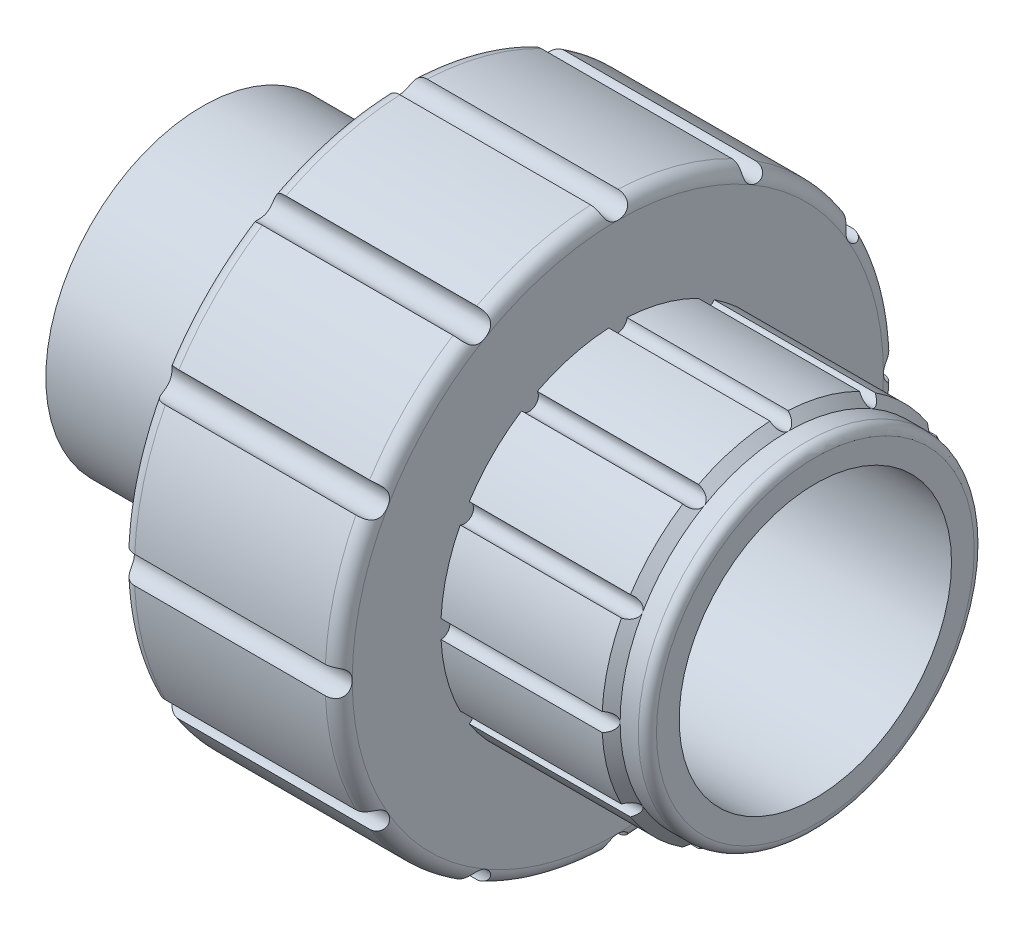
from build123d import *

# Parameters (mm, degrees)
SKETCH_1_R               = 11.5
SKETCH_1_R_2             = 10
EXTRUDE_1_DEPTH          = 45
EXTRUDE_START            = -14.5
SKETCH_2_R               = 20.5
EXTRUDE_1_2_DEPTH        = 30.5
CUT_EXTRUDE_START        = -16
SKETCH_3_OUTSIDE_W       = 57.68
SKETCH_3_OUTSIDE_H       = 57.68
SKETCH_3_OUTSIDE_R       = 13
CUT_EXTRUDE_1_DEPTH      = 27.080280417
FILLET_2_R               = 1
CUT_EXTRUDE_2_REACH      = 44.08
SKETCH_4_R               = 1
SKETCH_5_R               = 0.666666667
CUT_EXTRUDE_3_DEPTH      = 14.5
PATTERN_CIRCULAR_1_COUNT = 12
SKETCH_6_OUTSIDE_W       = 57.62
SKETCH_6_OUTSIDE_H       = 57.62
SKETCH_6_OUTSIDE_R       = 12.333333333
CUT_EXTRUDE_4_DEPTH      = 2
SKETCH_7_R               = 10
CUT_EXTRUDE_5_DEPTH      = 54.511692161
FILLET_3_R               = 0.666666667
SKETCH_8_OUTSIDE_W       = 61.62
SKETCH_8_OUTSIDE_H       = 61.62
SKETCH_8_OUTSIDE_R       = 12.333333333
CUT_EXTRUDE_6_DEPTH      = 2
CUT_EXTRUDE_6_DRAFT      = -45


with BuildPart() as part:
    # Эскиз1 → Extrude 1 (new body)
    with BuildSketch(Plane(origin=(0, 0, 0), x_dir=(0, 0, -1), z_dir=(1, 0, 0))):
        Circle(SKETCH_1_R)
        Circle(SKETCH_1_R_2, mode=Mode.SUBTRACT)
    extrude(amount=-EXTRUDE_1_DEPTH)

    # Эскиз2 → Extrude 1 2 (add)
    with BuildSketch(Plane.ZY.offset(45).offset(EXTRUDE_START)):
        Circle(SKETCH_2_R)
    extrude(amount=-EXTRUDE_1_2_DEPTH)

    # Эскиз3 outside → Вырез-Вытянуть1 (cut, through all)
    with BuildSketch(Plane.ZY.offset(30.5).offset(CUT_EXTRUDE_START)):
        Rectangle(SKETCH_3_OUTSIDE_W, SKETCH_3_OUTSIDE_H)
        Circle(SKETCH_3_OUTSIDE_R, mode=Mode.SUBTRACT)
    extrude(amount=-CUT_EXTRUDE_1_DEPTH, mode=Mode.SUBTRACT)

    # Скругление2
    fillet_2_edges = [part.edges().sort_by_distance(p)[0] for p in [
        (-30.5, 0, -20.5),
        (-14.5, 0, -20.5),
    ]]
    fillet(fillet_2_edges, radius=FILLET_2_R)

    # Эскиз4 → Вырез-Вытянуть2 (cut, up to next)
    with BuildSketch(Plane.ZY.offset(30.5), mode=Mode.PRIVATE) as cut_extrude_2_sk1:
        with Locations((0, 20.5)):
            Circle(SKETCH_4_R)
    cut_extrude_2_tool1 = extrude(cut_extrude_2_sk1.sketch, amount=-CUT_EXTRUDE_2_REACH, mode=Mode.PRIVATE) & part.part
    cut_extrude_2 = cut_extrude_2_tool1.solids().sort_by_distance((-30.5, 20.5, 0))[0]
    add(cut_extrude_2, mode=Mode.SUBTRACT)

    # Эскиз5 → Вырез-Вытянуть3 (cut)
    with BuildSketch(Plane(origin=(0, 0, 0), x_dir=(0, 0, -1), z_dir=(1, 0, 0))):
        with Locations((0, 13)):
            Circle(SKETCH_5_R)
    cut_extrude_3 = extrude(amount=-CUT_EXTRUDE_3_DEPTH, mode=Mode.SUBTRACT)

    # Круговой массив1: Вырез-Вытянуть2, Вырез-Вытянуть3 ×12 about axis
    pattern_circular_1_axis = Axis((0, 0, 0), (1, 0, 0))
    add([cut_extrude_2.rotate(pattern_circular_1_axis, i * 360 / PATTERN_CIRCULAR_1_COUNT) for i in range(1, PATTERN_CIRCULAR_1_COUNT)], mode=Mode.SUBTRACT)
    add([cut_extrude_3.rotate(pattern_circular_1_axis, i * 360 / PATTERN_CIRCULAR_1_COUNT) for i in range(1, PATTERN_CIRCULAR_1_COUNT)], mode=Mode.SUBTRACT)

    # Эскиз6 outside → Вырез-Вытянуть4 (cut)
    with BuildSketch(Plane(origin=(0, 0, 0), x_dir=(0, 0, -1), z_dir=(1, 0, 0))):
        Rectangle(SKETCH_6_OUTSIDE_W, SKETCH_6_OUTSIDE_H)
        Circle(SKETCH_6_OUTSIDE_R, mode=Mode.SUBTRACT)
    extrude(amount=-CUT_EXTRUDE_4_DEPTH, mode=Mode.SUBTRACT)

    # Эскиз7 → Вырез-Вытянуть5 (cut, through all)
    with BuildSketch(Plane(origin=(0, 0, 0), x_dir=(0, 0, -1), z_dir=(1, 0, 0))):
        Circle(SKETCH_7_R)
    extrude(amount=-CUT_EXTRUDE_5_DEPTH, mode=Mode.SUBTRACT)

    # Скругление3
    fillet_3_edges = [part.edges().sort_by_distance(p)[0] for p in [
        (0, 0, 12.333333333),
    ]]
    fillet(fillet_3_edges, radius=FILLET_3_R)


with BuildPart() as cut_extrude_6_tool:
    # Эскиз8 outside → Вырез-Вытянуть6 (with draft: the straight prism first)
    with BuildSketch(Plane(origin=(-2, 0, 0), x_dir=(0, 0, -1), z_dir=(1, 0, 0))):
        Rectangle(SKETCH_8_OUTSIDE_W, SKETCH_8_OUTSIDE_H)
        Circle(SKETCH_8_OUTSIDE_R, mode=Mode.SUBTRACT)
    extrude(amount=-CUT_EXTRUDE_6_DEPTH)
    # Вырез-Вытянуть6: the draft: its side faces are tilted about the plane it starts from
    cut_extrude_6_sides = [cut_extrude_6_tool.faces().sort_by_distance(p)[0] for p in [
        (-3, -30.81, 0),
        (-3, 0, -30.81),
        (-3, 30.81, 0),
        (-3, 0, 30.81),
        (-3, 0, 12.333333333),
    ]]
    draft(cut_extrude_6_sides, Plane(origin=(-2, 0, 0), x_dir=(0, 0, -1), z_dir=(1, 0, 0)), CUT_EXTRUDE_6_DRAFT)


with BuildPart() as part_1:
    add(part.part)

    # Вырез-Вытянуть6: cut by cut_extrude_6_tool
    add(cut_extrude_6_tool.part, mode=Mode.SUBTRACT)


solid = part_1.part
